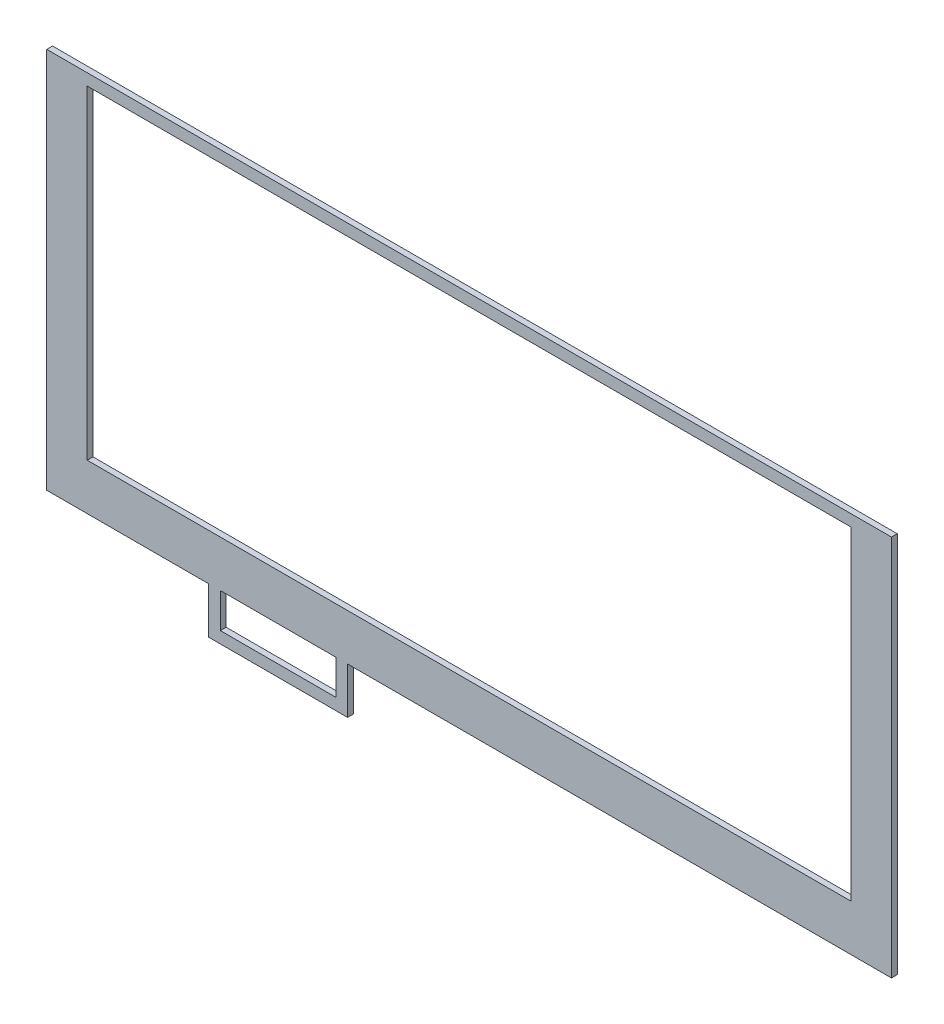
from build123d import *

# Parameters (mm, degrees)
CROQUIS2_W              = 730
CROQUIS2_H              = 330
SALIENTE_EXTRUIR2_DEPTH = 5
CROQUIS4_W              = 660
CROQUIS4_H              = 280
CORTAR_EXTRUIR1_DEPTH   = 5
SALIENTE_EXTRUIR3_DEPTH = 5


with BuildPart() as part:
    # Croquis2 → Saliente-Extruir2 (new body)
    with BuildSketch(Plane.XY):
        Rectangle(CROQUIS2_W, CROQUIS2_H)
    extrude(amount=SALIENTE_EXTRUIR2_DEPTH)

    # Croquis4 → Cortar-Extruir1 (cut)
    with BuildSketch(Plane.XY.offset(5)):
        with Locations((0, 15)):
            Rectangle(CROQUIS4_W, CROQUIS4_H)
    extrude(amount=-CORTAR_EXTRUIR1_DEPTH, mode=Mode.SUBTRACT)

    # Croquis5 → Saliente-Extruir3 (add)
    with BuildSketch(Plane.XY.offset(5)):
        Polygon((-215, -165), (-225, -165), (-225, -205), (-105, -205), (-105, -165), (-115, -165), (-115, -195), (-215, -195), align=None)
    extrude(amount=-SALIENTE_EXTRUIR3_DEPTH)


solid = part.part
